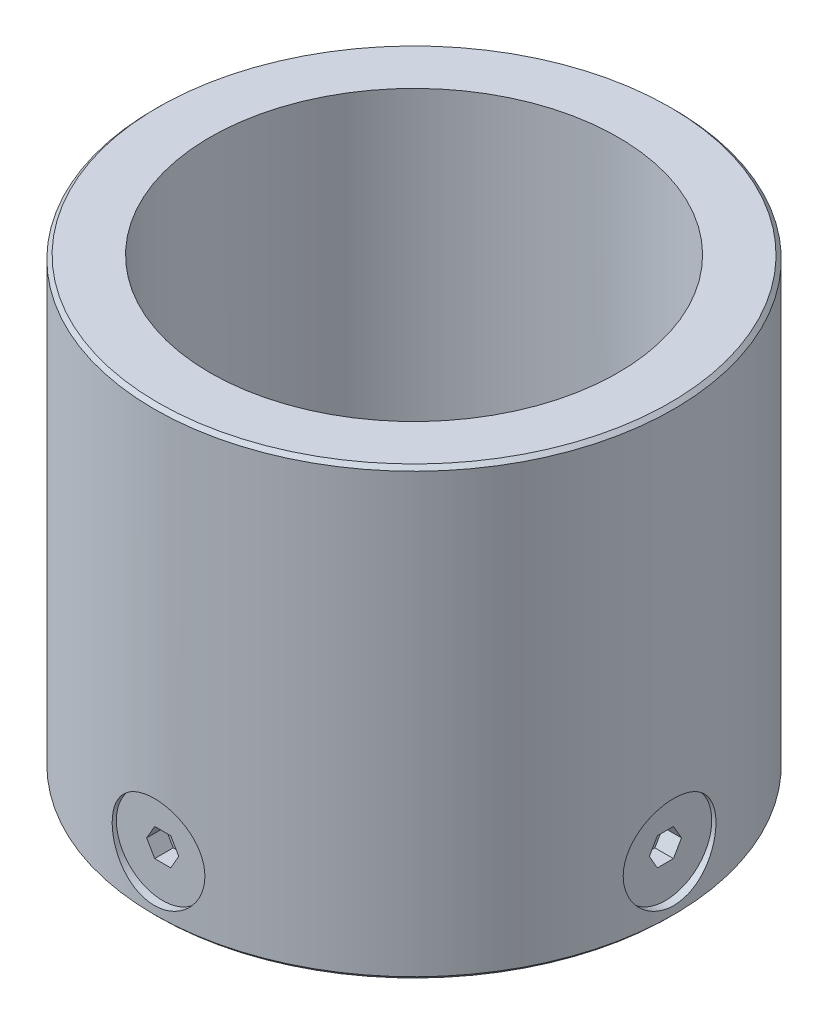
from build123d import *

# Parameters (mm, degrees)
SKETCH_1_R               = 14
SKETCH_1_R_2             = 11
EXTRUDE_1_DEPTH          = 24
CHAMFER_1_SIZE           = 0.2
SKETCH_2_R               = 2.5
CUT_EXTRUDE_1_DEPTH      = 32.112698372
EXTRUDE_START            = 12
SKETCH_2_3_R             = 2.5
EXTRUDE_2_DEPTH          = 1.55
CUT_EXTRUDE_START        = 13.55
CUT_EXTRUDE_2_DEPTH      = 1
PATTERN_CIRCULAR_1_COUNT = 4
PATTERN_CIRCULAR_2_COUNT = 4


with BuildPart() as part:
    # Эскиз1 → Бобышка-Вытянуть1 (new body)
    with BuildSketch(Plane(origin=(0, 0, 0), x_dir=(1, 0, 0), z_dir=(0, 1, 0))):
        with Locations(Location((0, 0, 0), (0, 0, 270))):
            Circle(SKETCH_1_R)
        with Locations(Location((0, 0, 0), (0, 0, 270))):
            Circle(SKETCH_1_R_2, mode=Mode.SUBTRACT)
    extrude(amount=EXTRUDE_1_DEPTH)

    # Фаска1
    chamfer_1_edges = [part.edges().sort_by_distance(p)[0] for p in [
        (0, 0, -14),
        (0, 24, -14),
    ]]
    chamfer(chamfer_1_edges, length=CHAMFER_1_SIZE)

    # Эскиз2 → Вырез-Вытянуть1 (cut, through all)
    with BuildSketch(Plane(origin=(0, 0, 0), x_dir=(0, 0, -1), z_dir=(1, 0, 0))):
        with Locations(Location((0, 3.127422807, 0), (0, 0, 180))):
            Circle(SKETCH_2_R)
    cut_extrude_1 = extrude(amount=CUT_EXTRUDE_1_DEPTH, mode=Mode.SUBTRACT)

    # Круговой массив1: Вырез-Вытянуть1 ×4 about axis
    pattern_circular_1_axis = Axis((0, 24, 0), (0, -1, 0))
    for i in range(1, PATTERN_CIRCULAR_1_COUNT):
        add(cut_extrude_1.rotate(pattern_circular_1_axis, i * 360 / PATTERN_CIRCULAR_1_COUNT), mode=Mode.SUBTRACT)


with BuildPart() as body_2:
    # Эскиз2<3> → Бобышка-Вытянуть2 (new body)
    # profile 1 of 2: a face of its own
    with BuildSketch(Plane(origin=(0, 0, 0), x_dir=(0, 0, -1), z_dir=(1, 0, 0)).offset(EXTRUDE_START)):
        with Locations(Location((0, 3.127422807, 0), (0, 0, 180))):
            Circle(SKETCH_2_3_R)
        Polygon((0.433012702, 2.377422807), (0.866025404, 3.127422807), (0.433012702, 3.877422807), (-0.433012702, 3.877422807), (-0.866025404, 3.127422807), (-0.433012702, 2.377422807), align=None, mode=Mode.SUBTRACT)
    # profile 2 of 2: a face of its own
    with BuildSketch(Plane(origin=(0, 0, 0), x_dir=(0, 0, -1), z_dir=(1, 0, 0)).offset(EXTRUDE_START)):
        Polygon((-0.433012702, 2.377422807), (0.433012702, 2.377422807), (0.866025404, 3.127422807), (0.433012702, 3.877422807), (-0.433012702, 3.877422807), (-0.866025404, 3.127422807), align=None)
    extrude(amount=EXTRUDE_2_DEPTH)

    # Эскиз2<4> → Вырез-Вытянуть2 (cut)
    with BuildSketch(Plane(origin=(0, 0, 0), x_dir=(0, 0, -1), z_dir=(1, 0, 0)).offset(CUT_EXTRUDE_START)):
        Polygon((-0.433012702, 2.377422807), (0.433012702, 2.377422807), (0.866025404, 3.127422807), (0.433012702, 3.877422807), (-0.433012702, 3.877422807), (-0.866025404, 3.127422807), align=None)
    extrude(amount=-CUT_EXTRUDE_2_DEPTH, mode=Mode.SUBTRACT)


with BuildPart() as pattern_circular_2_1:
    # Круговой массив2: pattern copy
    add(body_2.part.rotate(Axis((0, 0, 0), (0, 1, 0)), 1 * 360 / PATTERN_CIRCULAR_2_COUNT))


with BuildPart() as pattern_circular_2_2:
    # Круговой массив2: pattern copy
    add(body_2.part.rotate(Axis((0, 0, 0), (0, 1, 0)), 2 * 360 / PATTERN_CIRCULAR_2_COUNT))


with BuildPart() as pattern_circular_2_3:
    # Круговой массив2: pattern copy
    add(body_2.part.rotate(Axis((0, 0, 0), (0, 1, 0)), 3 * 360 / PATTERN_CIRCULAR_2_COUNT))


solid = Compound([part.part, body_2.part, pattern_circular_2_1.part, pattern_circular_2_2.part, pattern_circular_2_3.part])
